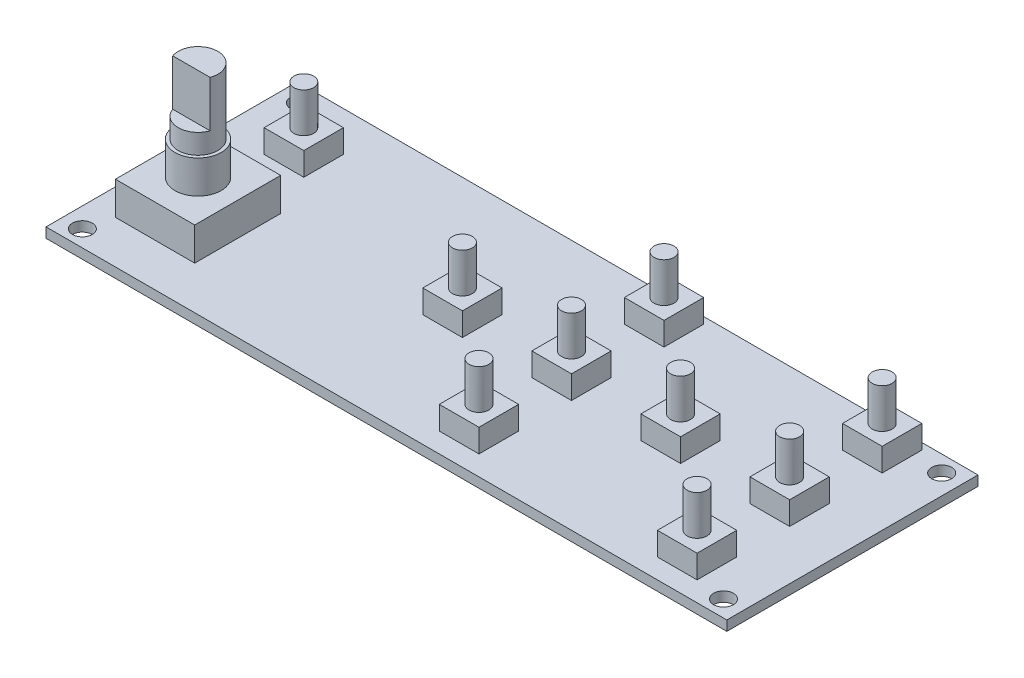
from build123d import *
from build123d.topology import SkipClean

# Parameters (mm, degrees)
SKETCH1_W           = 103
SKETCH1_H           = 38
BOSS_EXTRUDE1_DEPTH = 1.5
SKETCH2_R           = 1.5
CUT_EXTRUDE1_DEPTH  = 55.913568451
SKETCH3_R           = 1.5
BOSS_EXTRUDE2_DEPTH = 9.5
SKETCH5_W           = 6
SKETCH5_H           = 6
BOSS_EXTRUDE3_DEPTH = 3.5
BOSS_EXTRUDE4_DEPTH = 20
SKETCH7_R           = 3
BOSS_EXTRUDE5_DEPTH = 13
SKETCH8_R           = 3.5
BOSS_EXTRUDE6_DEPTH = 10
SKETCH9_W           = 12
SKETCH9_H           = 13
BOSS_EXTRUDE7_DEPTH = 5


with BuildPart() as part:
    # Sketch1 → Boss-Extrude1 (new body)
    with BuildSketch(Plane(origin=(0, 0, 0), x_dir=(1, 0, 0), z_dir=(0, 1, 0))):
        Rectangle(SKETCH1_W, SKETCH1_H)
    extrude(amount=BOSS_EXTRUDE1_DEPTH)

    # Sketch2 → Cut-Extrude1 (cut, through all)
    with BuildSketch(Plane(origin=(0, 1.5, 0), x_dir=(1, 0, 0), z_dir=(0, 1, 0))):
        with Locations(Location((-48.5, 16.5, 0), (0, 0, 270))):
            Circle(SKETCH2_R)
        with Locations(Location((-48.5, -16.5, 0), (0, 0, 270))):
            Circle(SKETCH2_R)
        with Locations(Location((48.5, -16.5, 0), (0, 0, 270))):
            Circle(SKETCH2_R)
        with Locations(Location((48.5, 16.5, 0), (0, 0, 270))):
            Circle(SKETCH2_R)
    extrude(amount=-CUT_EXTRUDE1_DEPTH, mode=Mode.SUBTRACT)

    # Sketch3 → Boss-Extrude2 (add)
    with BuildSketch(Plane(origin=(0, 1.5, 0), x_dir=(1, 0, 0), z_dir=(0, 1, 0))):
        with Locations(Location((41, 15, 0), (0, 0, 270))):
            Circle(SKETCH3_R)
        with Locations(Location((41, 1, 0), (0, 0, 270))):
            Circle(SKETCH3_R)
        with Locations(Location((41, -13, 0), (0, 0, 270))):
            Circle(SKETCH3_R)
        with Locations(Location((24.5, 1, 0), (0, 0, 270))):
            Circle(SKETCH3_R)
        with Locations(Location((8, 1, 0), (0, 0, 270))):
            Circle(SKETCH3_R)
        with Locations(Location((8, 15, 0), (0, 0, 270))):
            Circle(SKETCH3_R)
        with Locations(Location((8, -13, 0), (0, 0, 270))):
            Circle(SKETCH3_R)
        with Locations(Location((-8.5, 1, 0), (0, 0, 270))):
            Circle(SKETCH3_R)
        with Locations(Location((-41.5, 10, 0), (0, 0, 270))):
            Circle(SKETCH3_R)
    extrude(amount=BOSS_EXTRUDE2_DEPTH)

    # Sketch5 → Boss-Extrude3 (add)
    with BuildSketch(Plane(origin=(0, 1.5, 0), x_dir=(1, 0, 0), z_dir=(0, 1, 0))):
        with Locations((8, 15)):
            Rectangle(SKETCH5_W, SKETCH5_H)
        with Locations((24.5, 1)):
            Rectangle(SKETCH5_W, SKETCH5_H)
        with Locations((8, 1)):
            Rectangle(SKETCH5_W, SKETCH5_H)
        with Locations((-8.5, 1)):
            Rectangle(SKETCH5_W, SKETCH5_H)
        with Locations((8, -13)):
            Rectangle(SKETCH5_W, SKETCH5_H)
        with Locations((41, -13)):
            Rectangle(SKETCH5_W, SKETCH5_H)
        with Locations((41, 1)):
            Rectangle(SKETCH5_W, SKETCH5_H)
        with Locations((41, 15)):
            Rectangle(SKETCH5_W, SKETCH5_H)
        with Locations((-41.5, 10)):
            Rectangle(SKETCH5_W, SKETCH5_H)
    extrude(amount=BOSS_EXTRUDE3_DEPTH)

    # Sketch6 → Boss-Extrude4 (add)
    with BuildSketch(Plane(origin=(0, 1.5, 0), x_dir=(1, 0, 0), z_dir=(0, 1, 0))):
        with BuildLine():
            Line((-38.671572875, -7), (-44.328427125, -7))
            ThreePointArc((-44.328427125, -7), (-41.5, -3), (-38.671572875, -7))
        make_face()
    extrude(amount=BOSS_EXTRUDE4_DEPTH)

    # Sketch7 → Boss-Extrude5 (add)
    with SkipClean():  # the faces are left unmerged after this step: merging them gives an invalid solid
        with BuildSketch(Plane(origin=(0, 1.5, 0), x_dir=(1, 0, 0), z_dir=(0, 1, 0))):
            with Locations(Location((-41.5, -6, 0), (0, 0, 340.528779366))):
                Circle(SKETCH7_R)
        extrude(amount=BOSS_EXTRUDE5_DEPTH)

    # Sketch8 → Boss-Extrude6 (add)
    with SkipClean():  # the faces are left unmerged after this step: merging them gives an invalid solid
        with BuildSketch(Plane(origin=(0, 1.5, 0), x_dir=(1, 0, 0), z_dir=(0, 1, 0))):
            with Locations(Location((-41.5, -6, 0), (0, 0, 270))):
                Circle(SKETCH8_R)
        extrude(amount=BOSS_EXTRUDE6_DEPTH)

    # Sketch9 → Boss-Extrude7 (add)
    with SkipClean():  # the faces are left unmerged after this step: merging them gives an invalid solid
        with BuildSketch(Plane(origin=(0, 1.5, 0), x_dir=(1, 0, 0), z_dir=(0, 1, 0))):
            with Locations((-41.5, -6)):
                Rectangle(SKETCH9_W, SKETCH9_H)
        extrude(amount=BOSS_EXTRUDE7_DEPTH)


solid = part.part
